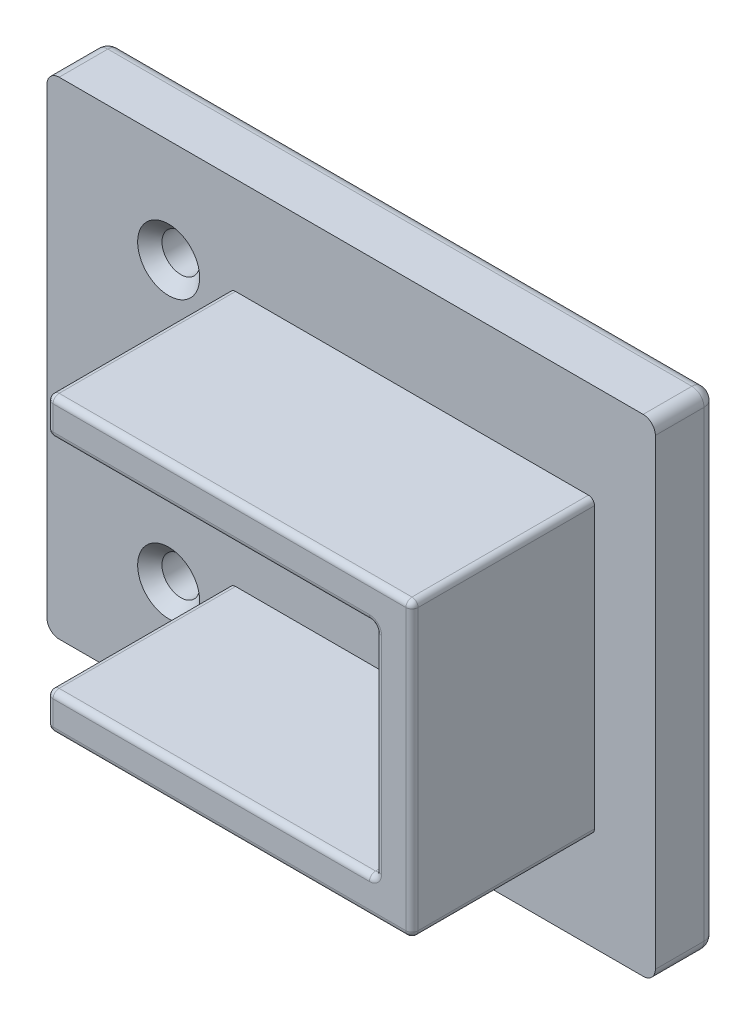
from build123d import *

# Parameters (mm, degrees)
SKETCH_2_W          = 50
SKETCH_2_H          = 40
EXTRUDE_1_DEPTH     = 5
EXTRUDE_START       = -8
SKETCH_5_W          = 30
SKETCH_5_H          = 15
EXTRUDE_2_DEPTH     = 3
SKETCH_6_W          = 30
SKETCH_6_H          = 15
EXTRUDE_3_DEPTH     = 3
CUT_EXTRUDE_1_REACH = 39.749
SKETCH_7_R          = 1.55
SKETCH_8_W          = 15
SKETCH_8_H          = 21
EXTRUDE_4_DEPTH     = 3
FILLET_4_R          = 0.5
CHAMFER_1_SIZE      = 1
FILLET_3_R          = 1


with BuildPart() as part:
    # 草图2 → 凸台-拉伸1 (new body)
    with BuildSketch(Plane.XY):
        Rectangle(SKETCH_2_W, SKETCH_2_H)
    extrude(amount=EXTRUDE_1_DEPTH)

    # 草图5 → 凸台-拉伸2 (add)
    with BuildSketch(Plane.XZ.offset(20).offset(EXTRUDE_START)):
        with Locations((5, 12.5)):
            Rectangle(SKETCH_5_W, SKETCH_5_H)
    extrude(amount=-EXTRUDE_2_DEPTH)

    # 草图6 → 凸台-拉伸3 (add)
    with BuildSketch(Plane(origin=(0, 20, 0), x_dir=(1, 0, 0), z_dir=(0, 1, 0)).offset(EXTRUDE_START)):
        with Locations((5, -12.5)):
            Rectangle(SKETCH_6_W, SKETCH_6_H)
    extrude(amount=-EXTRUDE_3_DEPTH)

    # 草图7 → 切除-拉伸1 (cut, up to next)
    with BuildSketch(Plane(origin=(0, 0, 0), x_dir=(-1, 0, 0), z_dir=(0, 0, -1)), mode=Mode.PRIVATE) as cut_extrude_1_sk1:
        with Locations((-10, 0)):
            Circle(SKETCH_7_R)
    cut_extrude_1_tool1 = extrude(cut_extrude_1_sk1.sketch, amount=-CUT_EXTRUDE_1_REACH, mode=Mode.PRIVATE) & part.part
    # 草图7 → 切除-拉伸1 (cut, up to next)
    with BuildSketch(Plane(origin=(0, 0, 0), x_dir=(-1, 0, 0), z_dir=(0, 0, -1)), mode=Mode.PRIVATE) as cut_extrude_1_sk2:
        with Locations((15, -11.5)):
            Circle(SKETCH_7_R)
    cut_extrude_1_tool2 = extrude(cut_extrude_1_sk2.sketch, amount=-CUT_EXTRUDE_1_REACH, mode=Mode.PRIVATE) & part.part
    # 草图7 → 切除-拉伸1 (cut, up to next)
    with BuildSketch(Plane(origin=(0, 0, 0), x_dir=(-1, 0, 0), z_dir=(0, 0, -1)), mode=Mode.PRIVATE) as cut_extrude_1_sk3:
        with Locations((15, 11.5)):
            Circle(SKETCH_7_R)
    cut_extrude_1_tool3 = extrude(cut_extrude_1_sk3.sketch, amount=-CUT_EXTRUDE_1_REACH, mode=Mode.PRIVATE) & part.part
    add(cut_extrude_1_tool1.solids().sort_by_distance((10, 0, 0))[0], mode=Mode.SUBTRACT)
    add(cut_extrude_1_tool2.solids().sort_by_distance((-15, -11.5, 0))[0], mode=Mode.SUBTRACT)
    add(cut_extrude_1_tool3.solids().sort_by_distance((-15, 11.5, 0))[0], mode=Mode.SUBTRACT)

    # 草图8 → 凸台-拉伸4 (add)
    with BuildSketch(Plane(origin=(20, 0, 0), x_dir=(0, 0, -1), z_dir=(1, 0, 0))):
        with Locations((-12.5, -1.5)):
            Rectangle(SKETCH_8_W, SKETCH_8_H)
    extrude(amount=-EXTRUDE_4_DEPTH)

    # 圆角4
    fillet_4_edges = [part.edges().sort_by_distance(p)[0] for p in [
        (-10, -9, 12.5),
        (-10, -10.5, 20),
        (20, 0, 20),
        (20, -12, 12.5),
        (5, -12, 20),
        (-10, -12, 12.5),
        (3.5, 9, 20),
        (-10, 9, 12.5),
        (-10, 10.5, 20),
        (-10, 12, 12.5),
        (5, 12, 20),
        (20, 12, 12.5),
        (3.5, -9, 20),
        (17, 0, 20),
        (17, -9, 12.5),
        (17, 9, 12.5),
    ]]
    fillet(fillet_4_edges, radius=FILLET_4_R)

    # 倒角1
    chamfer_1_edges = [part.edges().sort_by_distance(p)[0] for p in [
        (11.55, 0, 0),
        (11.55, 0, 5),
        (-13.45, -11.5, 0),
        (-13.45, -11.5, 5),
        (-13.45, 11.5, 0),
        (-13.45, 11.5, 5),
    ]]
    chamfer(chamfer_1_edges, length=CHAMFER_1_SIZE)

    # 圆角3
    fillet_3_edges = [part.edges().sort_by_distance(p)[0] for p in [
        (12.55, 0, 0),
        (-12.45, -11.5, 0),
        (-12.45, 11.5, 0),
        (0, -20, 0),
        (-25, 0, 0),
        (0, 20, 0),
        (25, 0, 0),
        (25, -20, 2.5),
        (-25, -20, 2.5),
        (-25, 20, 2.5),
        (25, 20, 2.5),
    ]]
    fillet(fillet_3_edges, radius=FILLET_3_R)


solid = part.part
